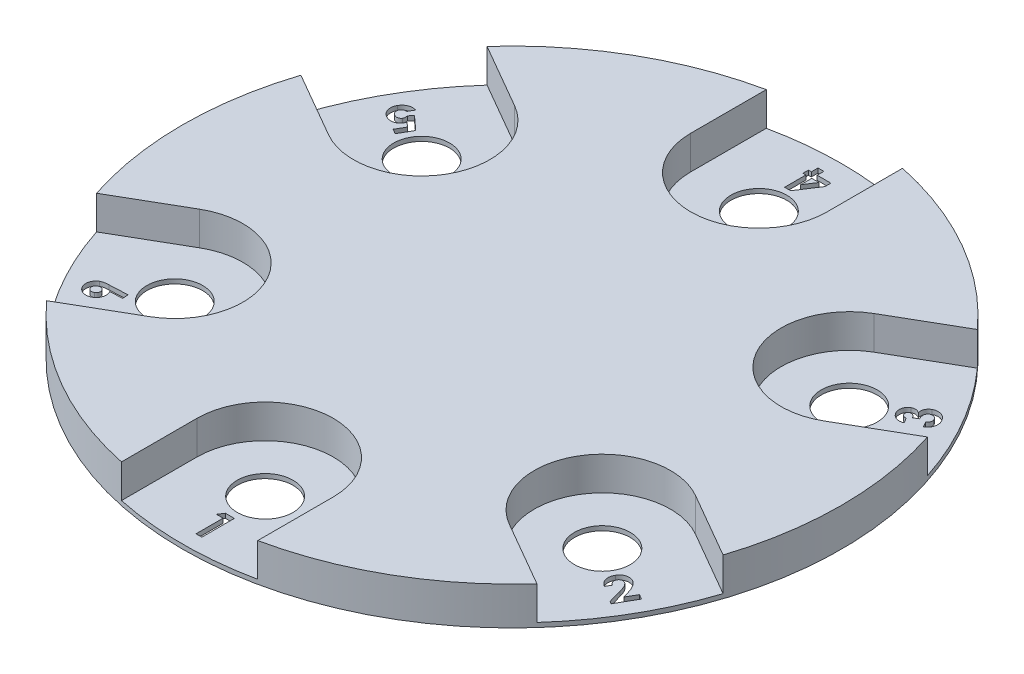
from build123d import *
from build123d.topology import SkipClean

# Parameters (mm, degrees)
BOSS_EXTRUDE1_DEPTH      = 15
BOSS_EXTRUDE2_START      = 2
SKETCH2_R                = 147.5
SKETCH2_R_2              = 12.5
SKETCH2_R_3              = 2.35
BOSS_EXTRUDE2_DEPTH      = 2
SKETCH5_R                = 6
BOSS_EXTRUDE3_DEPTH      = 25
CUT_EXTRUDE4_DEPTH       = 10
SKETCH9_R                = 2.35
CUT_EXTRUDE6_DEPTH       = 10
CUT_EXTRUDE12_DEPTH      = 15
SKETCH16_R               = 8
SKETCH16_R_2             = 5
BOSS_EXTRUDE5_DEPTH      = 5
FILLET2_R                = 10
CUT_EXTRUDE13_DEPTH      = 50
CUT_EXTRUDE13_DEPTH_BACK = 10


with BuildPart() as part:
    # Sketch1 → Boss-Extrude1 (new body)
    with BuildSketch(Plane(origin=(0, 0, 0), x_dir=(1, 0, 0), z_dir=(0, 1, 0))):
        with BuildLine():
            Line((-30.5, 110.5), (-30.5, 144.31216165))
            ThreePointArc((-30.5, 144.31216165), (-73.75, 127.738747058), (-109.727998064, 98.56985564))
            Line((-109.727998064, 98.56985564), (-80.445807118, 81.663774815))
            ThreePointArc((-80.445807118, 81.663774815), (-69.282032303, 40), (-110.945807118, 28.836225185))
            Line((-110.945807118, 28.836225185), (-140.227998064, 45.742306009))
            ThreePointArc((-140.227998064, 45.742306009), (-147.5, 0), (-140.227998064, -45.742306009))
            Line((-140.227998064, -45.742306009), (-110.945807118, -28.836225185))
            ThreePointArc((-110.945807118, -28.836225185), (-69.282032303, -40), (-80.445807118, -81.663774815))
            Line((-80.445807118, -81.663774815), (-109.727998064, -98.56985564))
            ThreePointArc((-109.727998064, -98.56985564), (-73.75, -127.738747058), (-30.5, -144.31216165))
            Line((-30.5, -144.31216165), (-30.5, -110.5))
            ThreePointArc((-30.5, -110.5), (0, -80), (30.5, -110.5))
            Line((30.5, -110.5), (30.5, -144.31216165))
            ThreePointArc((30.5, -144.31216165), (73.75, -127.738747058), (109.727998064, -98.56985564))
            Line((109.727998064, -98.56985564), (80.445807118, -81.663774815))
            ThreePointArc((80.445807118, -81.663774815), (69.282032303, -40), (110.945807118, -28.836225185))
            Line((110.945807118, -28.836225185), (140.227998064, -45.742306009))
            ThreePointArc((140.227998064, -45.742306009), (147.5, 0), (140.227998064, 45.742306009))
            Line((140.227998064, 45.742306009), (110.945807118, 28.836225185))
            ThreePointArc((110.945807118, 28.836225185), (69.282032303, 40), (80.445807118, 81.663774815))
            Line((80.445807118, 81.663774815), (109.727998064, 98.56985564))
            ThreePointArc((109.727998064, 98.56985564), (73.75, 127.738747058), (30.5, 144.31216165))
            Line((30.5, 144.31216165), (30.5, 110.5))
            ThreePointArc((30.5, 110.5), (0, 80), (-30.5, 110.5))
        make_face()
    extrude(amount=BOSS_EXTRUDE1_DEPTH)

    # Sketch2 → Boss-Extrude2 (add)
    with SkipClean():  # the faces are left unmerged after this step: merging them gives an invalid solid
        with BuildSketch(Plane(origin=(0, 0, 0), x_dir=(-1, 0, 0), z_dir=(0, -1, 0)).offset(BOSS_EXTRUDE2_START)):
            Circle(SKETCH2_R)
            with Locations((-95.695807118, 55.25)):
                Circle(SKETCH2_R_2, mode=Mode.SUBTRACT)
            with Locations((0, 110.5)):
                Circle(SKETCH2_R_2, mode=Mode.SUBTRACT)
            with Locations((95.695807118, 55.25)):
                Circle(SKETCH2_R_2, mode=Mode.SUBTRACT)
            with Locations((95.695807118, -55.25)):
                Circle(SKETCH2_R_2, mode=Mode.SUBTRACT)
            with Locations((0, -110.5)):
                Circle(SKETCH2_R_2, mode=Mode.SUBTRACT)
            with Locations((-95.695807118, -55.25)):
                Circle(SKETCH2_R_2, mode=Mode.SUBTRACT)
            with Locations((-29.344931419, -29.344931419)):
                Circle(SKETCH2_R_3, mode=Mode.SUBTRACT)
            with Locations((-29.344931419, 29.344931419)):
                Circle(SKETCH2_R_3, mode=Mode.SUBTRACT)
            with Locations((29.344931419, 29.344931419)):
                Circle(SKETCH2_R_3, mode=Mode.SUBTRACT)
            with Locations((29.344931419, -29.344931419)):
                Circle(SKETCH2_R_3, mode=Mode.SUBTRACT)
        extrude(amount=-BOSS_EXTRUDE2_DEPTH)

    # Sketch5 → Boss-Extrude3 (add)
    with SkipClean():  # the faces are left unmerged after this step: merging them gives an invalid solid
        with BuildSketch(Plane.XZ.offset(2)):
            Circle(SKETCH5_R)
        extrude(amount=BOSS_EXTRUDE3_DEPTH)

    # Sketch8 → Cut-Extrude4 (cut)
    # profile 1 of 6: a face of its own
    with SkipClean():  # the faces are left unmerged after this step: merging them gives an invalid solid
        with BuildSketch(Plane(origin=(0, 0, 0), x_dir=(1, 0, 0), z_dir=(0, 1, 0))):
            Polygon((-2.358300364, -125.947916667), (1.679086538, -125.947916667), (1.679086538, -140.5), (-0.932825855, -140.5), (-0.932825855, -128.373263889), (-3.91786859, -128.373263889), align=None)
        # profile 2 of 6: a face of its own
        with BuildSketch(Plane(origin=(0, 0, 0), x_dir=(1, 0, 0), z_dir=(0, 1, 0))):
            with BuildLine():
                Line((112.176320918, -67.191406206), (110.841213913, -69.505980358))
                add(Edge.make_bspline(
                    [(110.841213913, -69.505980358), (110.684116129, -69.400392176), (110.376710204, -69.19377925), (109.953486554, -68.852692106), (109.57704483, -68.491749005), (109.246492899, -68.112733726), (108.961789768, -67.714724314), (108.724182029, -67.29874279), (108.532634492, -66.864249776), (108.391433752, -66.413138379), (108.294129021, -65.953391263), (108.248138517, -65.490156863), (108.247066586, -65.027100158), (108.297433469, -64.563912183), (108.397451141, -64.102198553), (108.546052246, -63.641528367), (108.736857074, -63.178452471), (108.900692842, -62.880486366), (108.984307446, -62.728417508)],
                    knots=[0, 0, 0, 0, 1.154501079, 2.259105513, 3.311550315, 4.332738794, 5.32310421, 6.292303996, 7.25063568, 8.2143985, 9.171335445, 10.112849904, 11.049573671, 11.991703907, 12.94987053, 13.926728382, 14.941892913, 16, 16, 16, 16], degree=3))
                add(Edge.make_bspline(
                    [(108.984307446, -62.728417508), (109.095718932, -62.5476935), (109.313321315, -62.194713962), (109.704573811, -61.72422952), (110.139196859, -61.324956709), (110.611104734, -60.992720876), (111.11759287, -60.730742186), (111.656215655, -60.546766277), (112.221036458, -60.435164591), (112.802843497, -60.400167541), (113.381850966, -60.428966126), (113.936234952, -60.533480076), (114.460764673, -60.694733726), (114.778803949, -60.86343909), (114.936902432, -60.947303141)],
                    knots=[0, 0, 0, 0, 1.104069337, 2.156403507, 3.173016319, 4.167881568, 5.151887775, 6.130785205, 7.120726943, 8.139476423, 9.157623062, 10.129807374, 11.070320435, 12, 12, 12, 12], degree=3))
                add(Edge.make_bspline(
                    [(114.936902432, -60.947303141), (115.029134068, -61.003282321), (115.215948605, -61.116667759), (115.482916598, -61.314065578), (115.74660202, -61.529948197), (116.004308547, -61.769836787), (116.253090343, -62.035732002), (116.498552365, -62.320674432), (116.735605256, -62.630067349), (116.970545557, -62.963013614), (117.198854621, -63.329573571), (117.420804491, -63.73478093), (117.638853817, -64.180205588), (117.850574355, -64.668359641), (118.060146239, -65.196391857), (118.267054306, -65.764780333), (118.468377657, -66.374291387), (118.592656588, -66.796525456), (118.656545527, -67.013586278)],
                    knots=[0, 0, 0, 0, 0.710127908, 1.438359126, 2.183897539, 2.953538831, 3.754692063, 4.580580924, 5.429111789, 6.32024001, 7.263006244, 8.271063032, 9.361341779, 10.527535907, 11.773947238, 13.101804454, 14.510104335, 16, 16, 16, 16], degree=3))
                Line((118.656545527, -67.013586278), (119.318268868, -69.264028652))
                Line((119.318268868, -69.264028652), (121.883539968, -64.8243606))
                Line((121.883539968, -64.8243606), (124.078595808, -66.092420746))
                Line((124.078595808, -66.092420746), (119.093807647, -74.723974983))
                Line((119.093807647, -74.723974983), (117.959841217, -74.068081804))
                Line((117.959841217, -74.068081804), (116.25160387, -67.943497052))
                add(Edge.make_bspline(
                    [(116.25160387, -67.943497052), (116.201428103, -67.765582808), (116.104441768, -67.421686714), (115.958371257, -66.925539823), (115.804413079, -66.471095668), (115.658335029, -66.052405603), (115.50601187, -65.675188206), (115.358842541, -65.335651054), (115.210189669, -65.03674274), (115.015886109, -64.698149849), (114.767658169, -64.331112678), (114.450737243, -63.953649468), (114.1234789, -63.64012101), (113.88126605, -63.483017583), (113.765039952, -63.407631333)],
                    knots=[0, 0, 0, 0, 1.256867959, 2.429439999, 3.515817361, 4.518844834, 5.443861826, 6.281023943, 7.034435958, 7.712118835, 8.934338007, 10.040779141, 11.059865744, 12, 12, 12, 12], degree=3))
                add(Edge.make_bspline(
                    [(113.765039952, -63.407631333), (113.646621703, -63.346180702), (113.416798458, -63.226918819), (113.042454561, -63.135683019), (112.665912854, -63.122899182), (112.295091354, -63.193123037), (111.939965758, -63.327604497), (111.620352104, -63.540867761), (111.335953368, -63.819742653), (111.190561497, -64.047531225), (111.115231508, -64.16555234)],
                    knots=[0, 0, 0, 0, 1.034916509, 2.008540692, 2.969133977, 3.944869128, 4.926211327, 5.90332201, 6.913675642, 8, 8, 8, 8], degree=3))
                add(Edge.make_bspline(
                    [(111.115231508, -64.16555234), (111.080762504, -64.229003142), (111.013359502, -64.353079094), (110.937921114, -64.548232897), (110.881101645, -64.743983885), (110.848768157, -64.943684968), (110.841027747, -65.14606807), (110.852040593, -65.351315035), (110.887310967, -65.558629026), (110.946638465, -65.765094421), (111.024249423, -65.970220049), (111.127693054, -66.16693687), (111.246849472, -66.359065026), (111.391843577, -66.540711406), (111.558768402, -66.713938168), (111.742457782, -66.885143779), (111.949988642, -67.045079222), (112.099806671, -67.141938675), (112.176320918, -67.191406206)],
                    knots=[0, 0, 0, 0, 0.967346954, 1.891615089, 2.799014584, 3.696537969, 4.596422639, 5.50997533, 6.448189623, 7.409286192, 8.38684589, 9.383325634, 10.38464908, 11.414309184, 12.492613261, 13.608367401, 14.778558453, 16, 16, 16, 16], degree=3))
            make_face()
        # profile 3 of 6: a face of its own
        with BuildSketch(Plane(origin=(0, 0, 0), x_dir=(1, 0, 0), z_dir=(0, 1, 0))):
            with BuildLine():
                Line((113.184938873, 63.277800775), (114.499640312, 60.998207592))
                add(Edge.make_bspline(
                    [(114.499640312, 60.998207592), (114.377837788, 60.949842932), (114.138013151, 60.854614715), (113.774521601, 60.74404349), (113.41551985, 60.665764431), (113.063234708, 60.61064622), (112.714875235, 60.59234627), (112.372616706, 60.595983547), (112.035700957, 60.633657408), (111.816430821, 60.682381351), (111.70699291, 60.706699513)],
                    knots=[0, 0, 0, 0, 1.100637514, 2.16711431, 3.187091716, 4.185678312, 5.158749046, 6.113954241, 7.058672956, 8, 8, 8, 8], degree=3))
                add(Edge.make_bspline(
                    [(111.70699291, 60.706699513), (111.558189442, 60.748130802), (111.264078143, 60.830020091), (110.846249953, 61.008615098), (110.452016408, 61.220802894), (110.086792265, 61.477860149), (109.742755922, 61.768510729), (109.431763202, 62.10563088), (109.138763497, 62.474895586), (108.97455817, 62.748164583), (108.891024861, 62.887179948)],
                    knots=[0, 0, 0, 0, 1.010869218, 1.99799147, 2.969307492, 3.938723657, 4.918429718, 5.913645952, 6.938645537, 8, 8, 8, 8], degree=3))
                add(Edge.make_bspline(
                    [(108.891024861, 62.887179948), (108.821891922, 63.014390812), (108.686206102, 63.264065), (108.521029024, 63.651683788), (108.399537354, 64.042793329), (108.313181074, 64.434654418), (108.268841333, 64.829369457), (108.266889973, 65.225854841), (108.3021419, 65.625012834), (108.37492483, 66.021029831), (108.480800999, 66.406026372), (108.621675925, 66.768695026), (108.790221681, 67.107025076), (108.993144414, 67.416072495), (109.222076996, 67.702596031), (109.481752418, 67.962009505), (109.773343349, 68.195552747), (109.98657261, 68.326970353), (110.094953229, 68.393767572)],
                    knots=[0, 0, 0, 0, 1.10807358, 2.174793583, 3.219495373, 4.239455406, 5.242563574, 6.254351592, 7.270043138, 8.306073729, 9.333090522, 10.322281198, 11.280465358, 12.221397179, 13.147387919, 14.083750151, 15.026004476, 16, 16, 16, 16], degree=3))
                add(Edge.make_bspline(
                    [(110.094953229, 68.393767572), (110.233908908, 68.467096275), (110.508414725, 68.611956534), (110.951795535, 68.752282882), (111.408894048, 68.821183193), (111.877311104, 68.828471533), (112.351019353, 68.761742647), (112.825447796, 68.631137791), (113.292959306, 68.419269196), (113.58922215, 68.235003654), (113.741719305, 68.140155543)],
                    knots=[0, 0, 0, 0, 0.974570112, 1.925255358, 2.872042329, 3.837937071, 4.824805201, 5.833908719, 6.885034805, 8, 8, 8, 8], degree=3))
                add(Edge.make_bspline(
                    [(113.741719305, 68.140155543), (113.717524545, 68.249633136), (113.669856261, 68.465324837), (113.631221086, 68.789271311), (113.61118042, 69.106810813), (113.622519511, 69.417518767), (113.648300978, 69.723345656), (113.709129388, 70.021172063), (113.790479512, 70.313634438), (113.895027106, 70.598589787), (114.022507197, 70.873434483), (114.176731451, 71.132227143), (114.343487977, 71.38225923), (114.53835034, 71.612414399), (114.751616931, 71.828951581), (114.986148562, 72.031291756), (115.242385417, 72.217332217), (115.424863557, 72.328420569), (115.51700351, 72.384513181)],
                    knots=[0, 0, 0, 0, 1.084587699, 2.136844246, 3.154180313, 4.160940237, 5.143600227, 6.121206092, 7.097906682, 8.079846247, 9.056003269, 10.025476853, 10.99330664, 11.961501957, 12.939153063, 13.932779332, 14.956183924, 16, 16, 16, 16], degree=3))
                add(Edge.make_bspline(
                    [(115.51700351, 72.384513181), (115.656400394, 72.460509075), (115.930737003, 72.610070924), (116.363066562, 72.777997556), (116.800142626, 72.902277452), (117.243795278, 72.978888181), (117.694414926, 73.004168263), (118.150792261, 72.984444981), (118.613334188, 72.91236287), (119.076766656, 72.796189257), (119.532573334, 72.63769618), (119.969018406, 72.43363216), (120.37896583, 72.182118746), (120.767940041, 71.895194153), (121.12875985, 71.560533707), (121.467830748, 71.18727535), (121.780735814, 70.768533148), (121.964695413, 70.466044736), (122.058444816, 70.311890735)],
                    knots=[0, 0, 0, 0, 0.993527377, 1.955287111, 2.897436886, 3.83594311, 4.768709181, 5.719078948, 6.69169555, 7.695422729, 8.707857846, 9.709756724, 10.706540813, 11.715604557, 12.732128862, 13.783438489, 14.870396979, 16, 16, 16, 16], degree=3))
                add(Edge.make_bspline(
                    [(122.058444816, 70.311890735), (122.140823851, 70.162630929), (122.30234635, 69.86997374), (122.494487345, 69.415695997), (122.641486439, 68.963204784), (122.741883278, 68.511312894), (122.795095073, 68.060993545), (122.799843134, 67.611780437), (122.763468064, 67.163068124), (122.674967357, 66.71887309), (122.542842578, 66.284036002), (122.372704915, 65.861888735), (122.151215231, 65.462144593), (121.889561675, 65.078738542), (121.581860111, 64.715592129), (121.23404969, 64.367108307), (120.84133541, 64.038901551), (120.554978029, 63.842007807), (120.408509085, 63.741298621)],
                    knots=[0, 0, 0, 0, 1.080781249, 2.119113037, 3.122919527, 4.094945026, 5.050574497, 5.993659493, 6.940061788, 7.901022981, 8.860342232, 9.819483271, 10.78212307, 11.753151488, 12.759320435, 13.796572391, 14.872968757, 16, 16, 16, 16], degree=3))
                Line((120.408509085, 63.741298621), (119.052996515, 66.087938662))
                add(Edge.make_bspline(
                    [(119.052996515, 66.087938662), (119.187655558, 66.20483535), (119.443367817, 66.42681759), (119.755681364, 66.800423038), (119.977730848, 67.187184264), (120.109092729, 67.585280256), (120.156501471, 67.987900744), (120.123314345, 68.393042166), (120.007791177, 68.797627316), (119.875842645, 69.050716009), (119.808002442, 69.180839387)],
                    knots=[0, 0, 0, 0, 1.215812048, 2.308779549, 3.306708855, 4.242178214, 5.150446475, 6.055439415, 7.00022088, 8, 8, 8, 8], degree=3))
                add(Edge.make_bspline(
                    [(119.808002442, 69.180839387), (119.767347111, 69.247656705), (119.687377528, 69.379087272), (119.550215592, 69.560112984), (119.400312438, 69.721678188), (119.239254859, 69.865128368), (119.067336532, 69.99168511), (118.881683848, 70.096410773), (118.686106835, 70.185126157), (118.413045123, 70.271788251), (118.065418235, 70.336392342), (117.646312688, 70.33357542), (117.236720154, 70.234285597), (116.986031175, 70.108151834), (116.857940676, 70.043703302)],
                    knots=[0, 0, 0, 0, 0.820951101, 1.614821893, 2.380179406, 3.131809883, 3.87676154, 4.617156876, 5.366220277, 6.127759162, 7.62087363, 9.059762602, 10.497674375, 12, 12, 12, 12], degree=3))
                add(Edge.make_bspline(
                    [(116.857940676, 70.043703302), (116.78973405, 70.001634761), (116.654527551, 69.918241981), (116.474013608, 69.765354419), (116.315031671, 69.594656137), (116.177490973, 69.406623972), (116.058888732, 69.201248068), (115.967127768, 68.974969456), (115.893523457, 68.732260298), (115.844046647, 68.47240742), (115.821885315, 68.198954683), (115.823469249, 67.913680486), (115.860372646, 67.619007832), (115.925479765, 67.314020263), (116.019134953, 66.999222346), (116.143426499, 66.674569015), (116.294211061, 66.339106978), (116.41435348, 66.117322014), (116.476065092, 66.003401319)],
                    knots=[0, 0, 0, 0, 0.848466509, 1.681921424, 2.498142113, 3.315985831, 4.146380314, 5.005223533, 5.898042427, 6.831295342, 7.80297426, 8.802105615, 9.849699668, 10.944580868, 12.104758162, 13.327138069, 14.627074253, 16, 16, 16, 16], degree=3))
                Line((116.476065092, 66.003401319), (114.444253777, 64.831538839))
                add(Edge.make_bspline(
                    [(114.444253777, 64.831538839), (114.355790128, 64.958331394), (114.18990611, 65.196088471), (113.929850862, 65.507264103), (113.689524929, 65.7609731), (113.454619877, 65.949095527), (113.224513604, 66.088672397), (112.994489152, 66.191263303), (112.75817456, 66.260073297), (112.519357199, 66.291244994), (112.285213818, 66.291110872), (112.058978413, 66.263191641), (111.843901116, 66.199228275), (111.711887648, 66.130901488), (111.645776213, 66.096683905)],
                    knots=[0, 0, 0, 0, 1.631543613, 3.059414974, 4.278262358, 5.314924273, 6.226342713, 7.112821333, 7.966824641, 8.815635641, 9.646651462, 10.433090686, 11.215302614, 12, 12, 12, 12], degree=3))
                add(Edge.make_bspline(
                    [(111.645776213, 66.096683905), (111.566615765, 66.045353459), (111.412273967, 65.945272756), (111.224347927, 65.74514441), (111.088559015, 65.51102005), (110.997518237, 65.252262364), (110.96208785, 64.974780064), (110.988924337, 64.690124274), (111.065867271, 64.400298694), (111.163695851, 64.219627479), (111.214344255, 64.126089287)],
                    knots=[0, 0, 0, 0, 0.998984466, 1.947753752, 2.881940502, 3.854199926, 4.842042555, 5.825566253, 6.874239024, 8, 8, 8, 8], degree=3))
                add(Edge.make_bspline(
                    [(111.214344255, 64.126089287), (111.266393608, 64.045628767), (111.369294992, 63.886558608), (111.565158157, 63.678891169), (111.795165467, 63.509259179), (112.052339597, 63.376413889), (112.326480222, 63.277895537), (112.611702381, 63.234802493), (112.900306191, 63.223362301), (113.089068974, 63.259464824), (113.184938873, 63.277800775)],
                    knots=[0, 0, 0, 0, 1.000733368, 1.978446293, 2.966247666, 3.975356808, 4.997380958, 5.996461757, 6.982431784, 8, 8, 8, 8], degree=3))
            make_face()
        # profile 4 of 6: a face of its own
        with BuildSketch(Plane(origin=(0, 0, 0), x_dir=(1, 0, 0), z_dir=(0, 1, 0))):
            Polygon((-0.824967865, 125.574786325), (-3.544738248, 125.574786325), (-3.544738248, 135.089610043), (-4.850694444, 135.089610043), (-4.850694444, 137.514957265), (-3.544738248, 137.514957265), (-3.544738248, 140.5), (-0.932825855, 140.5), (-0.932825855, 137.514957265), (5.223824786, 137.514957265), (5.223824786, 134.870978983), align=None)
            Polygon((-0.932825855, 135.089610043), (-0.932825855, 130.13688777), (2.288338425, 135.089610043), align=None, mode=Mode.SUBTRACT)
        # profile 5 of 6: a face of its own
        with BuildSketch(Plane(origin=(0, 0, 0), x_dir=(1, 0, 0), z_dir=(0, 1, 0))):
            with BuildLine():
                Line((-108.089377642, 65.002180529), (-111.459211042, 59.166188775))
                Line((-111.459211042, 59.166188775), (-113.645521639, 60.42841876))
                Line((-113.645521639, 60.42841876), (-111.298881598, 64.49495647))
                Line((-111.298881598, 64.49495647), (-113.275306378, 66.313966887))
                add(Edge.make_bspline(
                    [(-113.275306378, 66.313966887), (-113.296066524, 66.232817656), (-113.336885098, 66.073262139), (-113.42369539, 65.847944459), (-113.515973399, 65.636158825), (-113.58728448, 65.504102333), (-113.622200993, 65.439442648)],
                    knots=[0, 0, 0, 0, 1.06420543, 2.092439393, 3.065988606, 4, 4, 4, 4], degree=3))
                add(Edge.make_bspline(
                    [(-113.622200993, 65.439442648), (-113.705001145, 65.302560129), (-113.867434144, 65.034031176), (-114.153698591, 64.66819868), (-114.463482852, 64.339628297), (-114.79948195, 64.048859712), (-115.16354699, 63.801000868), (-115.55140598, 63.588212694), (-115.966497413, 63.417641781), (-116.402342477, 63.283162661), (-116.850726084, 63.193652338), (-117.303806045, 63.149274109), (-117.757379147, 63.151091105), (-118.211059514, 63.206184812), (-118.6644414, 63.301546291), (-119.117220937, 63.446718057), (-119.569379845, 63.639383283), (-119.862670167, 63.798717344), (-120.012058097, 63.879874422)],
                    knots=[0, 0, 0, 0, 1.041508026, 2.043175864, 3.019433695, 3.980089598, 4.931838607, 5.883734992, 6.857217752, 7.850487817, 8.851194899, 9.830751981, 10.812046429, 11.799915004, 12.803182057, 13.826287158, 14.892815627, 16, 16, 16, 16], degree=3))
                add(Edge.make_bspline(
                    [(-120.012058097, 63.879874422), (-120.158646007, 63.969500796), (-120.447763662, 64.146272312), (-120.844753386, 64.454478436), (-121.202309886, 64.789276974), (-121.516117021, 65.155699217), (-121.79549181, 65.545551658), (-122.02927684, 65.968876653), (-122.220773952, 66.419951826), (-122.375479886, 66.891518775), (-122.481731252, 67.376101216), (-122.544450718, 67.859951914), (-122.556830455, 68.338753724), (-122.517401399, 68.811239035), (-122.43425975, 69.27872807), (-122.296999543, 69.739923866), (-122.115439713, 70.196488301), (-121.955698857, 70.486987281), (-121.874794726, 70.634116626)],
                    knots=[0, 0, 0, 0, 1.055785886, 2.082343212, 3.084049436, 4.062609617, 5.044011067, 6.028227449, 7.029274181, 8.053342162, 9.075316504, 10.075025092, 11.049197908, 12.014258794, 12.985789681, 13.963254867, 14.9684474, 16, 16, 16, 16], degree=3))
                add(Edge.make_bspline(
                    [(-121.874794726, 70.634116626), (-121.797421159, 70.763898679), (-121.644961965, 71.019625125), (-121.380152637, 71.371165505), (-121.099630154, 71.6947329), (-120.798118269, 71.987086234), (-120.477382141, 72.250982949), (-120.133884693, 72.481560554), (-119.771911924, 72.68419531), (-119.389641255, 72.851905893), (-118.995347703, 72.989685801), (-118.590975942, 73.088085063), (-118.181591484, 73.153812577), (-117.764874291, 73.178679595), (-117.341592595, 73.170747064), (-116.911580453, 73.123059234), (-116.474987614, 73.03823952), (-116.185954019, 72.955721094), (-116.038802972, 72.913709809)],
                    knots=[0, 0, 0, 0, 1.064186621, 2.096905199, 3.096744185, 4.079862237, 5.05317607, 6.019963199, 6.991758056, 7.972870521, 8.958275673, 9.931589506, 10.902104652, 11.876502018, 12.869705299, 13.882338009, 14.921868655, 16, 16, 16, 16], degree=3))
                Line((-116.038802972, 72.913709809), (-117.475937805, 70.424230809))
                add(Edge.make_bspline(
                    [(-117.475937805, 70.424230809), (-117.597514848, 70.428587596), (-117.833696112, 70.437051296), (-118.178357023, 70.393232537), (-118.502968016, 70.314807006), (-118.800097835, 70.18310381), (-119.073776677, 70.021323782), (-119.315138942, 69.819372131), (-119.52888908, 69.584745556), (-119.642485477, 69.404880487), (-119.700144452, 69.313585026)],
                    knots=[0, 0, 0, 0, 1.109804984, 2.155959184, 3.163698306, 4.149933146, 5.11373455, 6.059497778, 7.015044738, 8, 8, 8, 8], degree=3))
                add(Edge.make_bspline(
                    [(-119.700144452, 69.313585026), (-119.735375426, 69.248107), (-119.804909599, 69.118875253), (-119.886817907, 68.916970295), (-119.945935863, 68.711820857), (-119.980403299, 68.50339333), (-119.994976513, 68.292570057), (-119.989707172, 68.078594383), (-119.959883774, 67.8617279), (-119.907457256, 67.645185714), (-119.834924736, 67.432125836), (-119.741940744, 67.229140693), (-119.629941825, 67.035813034), (-119.495142293, 66.856583197), (-119.343064359, 66.685709192), (-119.169686243, 66.528225801), (-118.976844355, 66.381271222), (-118.836183083, 66.29617491), (-118.764403517, 66.25275019)],
                    knots=[0, 0, 0, 0, 0.997812901, 1.969349307, 2.919180086, 3.858649584, 4.80029085, 5.753074062, 6.727322429, 7.733628953, 8.740358278, 9.744548131, 10.726887462, 11.734123912, 12.750445359, 13.793955032, 14.874253371, 16, 16, 16, 16], degree=3))
                add(Edge.make_bspline(
                    [(-118.764403517, 66.25275019), (-118.622922282, 66.178223855), (-118.34990509, 66.034409935), (-117.911627097, 65.914275289), (-117.475971148, 65.875255371), (-117.119080972, 65.923188205), (-116.84420604, 65.993780461), (-116.652877557, 66.07211859), (-116.470866556, 66.158238378), (-116.306193756, 66.267320015), (-116.151116228, 66.39051856), (-116.014064228, 66.533747924), (-115.884171413, 66.689126232), (-115.814758116, 66.805547892), (-115.779360782, 66.864917157)],
                    knots=[0, 0, 0, 0, 1.688735906, 3.25876387, 4.776101482, 6.289492917, 7.045628948, 7.775410633, 8.47475427, 9.17387086, 9.86153951, 10.567210814, 11.269348664, 12, 12, 12, 12], degree=3))
                add(Edge.make_bspline(
                    [(-115.779360782, 66.864917157), (-115.744607032, 66.93119322), (-115.674416112, 67.065048642), (-115.600258854, 67.281064859), (-115.549275596, 67.50883896), (-115.527833402, 67.749615897), (-115.52709357, 68.002466438), (-115.555077043, 68.267776185), (-115.607022382, 68.54491787), (-115.661133388, 68.730973111), (-115.688993277, 68.826766533)],
                    knots=[0, 0, 0, 0, 0.887533944, 1.792520965, 2.702349485, 3.652965451, 4.656779893, 5.700387855, 6.816009077, 8, 8, 8, 8], degree=3))
                Line((-115.688993277, 68.826766533), (-114.138170293, 70.505853071))
                Line((-114.138170293, 70.505853071), (-108.089377642, 65.002180529))
            make_face()
        # profile 6 of 6: a face of its own
        with BuildSketch(Plane(origin=(0, 0, 0), x_dir=(1, 0, 0), z_dir=(0, 1, 0))):
            with BuildLine():
                Line((-108.791912114, -63.056254634), (-108.634497751, -65.653591624))
                Line((-108.634497751, -65.653591624), (-114.129425051, -65.924694138))
                add(Edge.make_bspline(
                    [(-114.129425051, -65.924694138), (-114.057821333, -66.056524935), (-113.916678086, -66.316386116), (-113.752666813, -66.723768505), (-113.637312444, -67.136777603), (-113.557826407, -67.554071439), (-113.531734315, -67.978475668), (-113.540973803, -68.408316378), (-113.602374952, -68.84347595), (-113.702581411, -69.278967706), (-113.845383093, -69.704990726), (-114.022267125, -70.112324992), (-114.239205778, -70.493475236), (-114.495031296, -70.848457053), (-114.788286645, -71.179219779), (-115.118847404, -71.486157722), (-115.48772109, -71.76721982), (-115.754542109, -71.931045714), (-115.890133852, -72.01429792)],
                    knots=[0, 0, 0, 0, 1.018338026, 2.007319446, 2.974571167, 3.927282038, 4.886485245, 5.856973584, 6.842580271, 7.865526957, 8.888132973, 9.889912956, 10.87710919, 11.86063677, 12.85646456, 13.874460374, 14.919854132, 16, 16, 16, 16], degree=3))
                add(Edge.make_bspline(
                    [(-115.890133852, -72.01429792), (-116.024720644, -72.088251079), (-116.289737752, -72.233873484), (-116.707883257, -72.397784413), (-117.128192607, -72.526183658), (-117.555590184, -72.605240643), (-117.987461133, -72.635614544), (-118.424086029, -72.628761468), (-118.866142116, -72.570991426), (-119.308265226, -72.473062556), (-119.739590043, -72.334216508), (-120.148260766, -72.159088702), (-120.531611968, -71.951692319), (-120.885255626, -71.704929745), (-121.213647872, -71.423879823), (-121.514422687, -71.106791467), (-121.791462157, -70.757001025), (-121.947395667, -70.500244413), (-122.026378927, -70.370192351)],
                    knots=[0, 0, 0, 0, 1.041763046, 2.051353072, 3.04293035, 4.022581766, 4.995208902, 5.978519677, 6.982683446, 8.016812889, 9.049678629, 10.054665785, 11.032003656, 12.003891977, 12.977190276, 13.961894674, 14.967661259, 16, 16, 16, 16], degree=3))
                add(Edge.make_bspline(
                    [(-122.026378927, -70.370192351), (-122.102138462, -70.230683458), (-122.250976269, -69.956603137), (-122.422023068, -69.526787332), (-122.553106437, -69.095385533), (-122.63135924, -68.658022671), (-122.663946236, -68.218378465), (-122.649016318, -67.775710272), (-122.586685948, -67.329463696), (-122.47910536, -66.884655603), (-122.332067172, -66.453050253), (-122.152742939, -66.044892267), (-121.946927737, -65.662912814), (-121.70415064, -65.313069797), (-121.430290864, -64.993168804), (-121.129123306, -64.699874275), (-120.795711705, -64.4347855), (-120.552055327, -64.285880982), (-120.428914651, -64.21062663)],
                    knots=[0, 0, 0, 0, 1.077273163, 2.116419726, 3.135316905, 4.13457865, 5.127084635, 6.124077708, 7.136651265, 8.181814891, 9.227311783, 10.229010968, 11.206485483, 12.169327126, 13.11484928, 14.062188885, 15.020656167, 16, 16, 16, 16], degree=3))
                add(Edge.make_bspline(
                    [(-120.428914651, -64.21062663), (-120.331404174, -64.157909898), (-120.134766452, -64.051602368), (-119.827051971, -63.91386582), (-119.502846863, -63.804912075), (-119.221102552, -63.724729998), (-118.975034597, -63.671472855), (-118.762298713, -63.633010044), (-118.521619776, -63.603102466), (-118.253668673, -63.5697864), (-117.957124991, -63.541806189), (-117.632687368, -63.51433568), (-117.280637575, -63.496125224), (-117.036726827, -63.482883694), (-116.91041213, -63.476026269)],
                    knots=[0, 0, 0, 0, 1.098453923, 2.215120709, 3.33589115, 4.485461064, 5.116379259, 5.830457112, 6.627221513, 7.519526552, 8.506534278, 9.579013926, 10.746237616, 12, 12, 12, 12], degree=3))
                Line((-116.91041213, -63.476026269), (-108.791912114, -63.056254634))
            make_face()
            with BuildLine():
                add(Edge.make_bspline(
                    [(-116.449829365, -67.084896294), (-116.517730665, -66.981635512), (-116.650029881, -66.780441713), (-116.914731314, -66.53490691), (-117.224543579, -66.354323503), (-117.571135721, -66.239945173), (-117.9371328, -66.18925593), (-118.309844011, -66.213312861), (-118.68076431, -66.313821373), (-118.911133521, -66.434137992), (-119.029675869, -66.496049974)],
                    knots=[0, 0, 0, 0, 1.00210531, 1.952506739, 2.905171773, 3.897133041, 4.901727284, 5.891420201, 6.914976533, 8, 8, 8, 8], degree=3))
                add(Edge.make_bspline(
                    [(-119.029675869, -66.496049974), (-119.142758687, -66.568593924), (-119.362558611, -66.709598146), (-119.632291856, -66.988524725), (-119.841437866, -67.306451518), (-119.98146465, -67.659023827), (-120.054244867, -68.023869992), (-120.060328831, -68.383628177), (-119.98745441, -68.731539172), (-119.881874091, -68.940783783), (-119.828408007, -69.04674567)],
                    knots=[0, 0, 0, 0, 1.084370473, 2.107699054, 3.113315164, 4.147317016, 5.15759702, 6.109268, 7.042529552, 8, 8, 8, 8], degree=3))
                add(Edge.make_bspline(
                    [(-119.828408007, -69.04674567), (-119.760530352, -69.1500507), (-119.627520786, -69.352481931), (-119.358728278, -69.600187371), (-119.045031484, -69.788230037), (-118.692013873, -69.916433779), (-118.316485427, -69.974557556), (-117.933855211, -69.956829528), (-117.552866704, -69.859766504), (-117.317397674, -69.736824578), (-117.196090048, -69.673488041)],
                    knots=[0, 0, 0, 0, 0.981808457, 1.923901433, 2.882453353, 3.879164247, 4.897378771, 5.889358535, 6.912651468, 8, 8, 8, 8], degree=3))
                add(Edge.make_bspline(
                    [(-117.196090048, -69.673488041), (-117.082869416, -69.602087554), (-116.862357652, -69.46302591), (-116.59543468, -69.18517357), (-116.386627113, -68.872592312), (-116.252271823, -68.522835379), (-116.184920403, -68.156920761), (-116.18788942, -67.787155448), (-116.278678356, -67.423502028), (-116.391846438, -67.199609912), (-116.449829365, -67.084896294)],
                    knots=[0, 0, 0, 0, 1.064723496, 2.073686132, 3.047963589, 4.047315269, 5.04051072, 6.002177851, 6.976393588, 8, 8, 8, 8], degree=3))
            make_face(mode=Mode.SUBTRACT)
        extrude(amount=-CUT_EXTRUDE4_DEPTH, mode=Mode.SUBTRACT)


with BuildPart() as cut_extrude4_piece_1:
    # of the separate pieces the step leaves, piece 1, a body of its own (cut_extrude4_pieces)
    add(part.part.solids().sort_by_distance((140.227998064, 0, -45.742306009))[0])

    # Sketch9 → Cut-Extrude6 (cut)
    with SkipClean():  # the faces are left unmerged after this step: merging them gives an invalid solid
        with BuildSketch(Plane.XZ.offset(2)):
            with Locations((29.344931419, 29.344931419)):
                Circle(SKETCH9_R)
            with Locations((-29.344931419, 29.344931419)):
                Circle(SKETCH9_R)
            with Locations((-29.344931419, -29.344931419)):
                Circle(SKETCH9_R)
            with Locations((29.344931419, -29.344931419)):
                Circle(SKETCH9_R)
        extrude(amount=-CUT_EXTRUDE6_DEPTH, mode=Mode.SUBTRACT)

    # Sketch14 → Cut-Extrude12 (cut)
    with SkipClean():  # the faces are left unmerged after this step: merging them gives an invalid solid
        with BuildSketch(Plane.XZ.offset(2)):
            with BuildLine():
                ThreePointArc((-136.699989579, 40.241307746), (-142.5, 0), (-136.699989579, -40.241307746))
                Line((-136.699989579, -40.241307746), (-69.978869047, -1.719850846))
                ThreePointArc((-69.978869047, -1.719850846), (-70, 0), (-69.978869047, 1.719850846))
                Line((-69.978869047, 1.719850846), (-136.699989579, 40.241307746))
            make_face()
            with BuildLine():
                Line((-69.814755108, -5.089201234), (-98.945807118, -21.908021954))
                ThreePointArc((-98.945807118, -21.908021954), (-66.683956091, -38.5), (-68.445807118, -74.735571585))
                Line((-68.445807118, -74.735571585), (-39.314755108, -57.916750865))
                ThreePointArc((-39.314755108, -57.916750865), (-60.621778265, -35), (-69.814755108, -5.089201234))
            make_face()
            with BuildLine():
                ThreePointArc((-68.445807118, 74.735571585), (-66.683956091, 38.5), (-98.945807118, 21.908021954))
                Line((-98.945807118, 21.908021954), (-69.814755108, 5.089201234))
                ThreePointArc((-69.814755108, 5.089201234), (-60.621778265, 35), (-39.314755108, 57.916750865))
                Line((-39.314755108, 57.916750865), (-68.445807118, 74.735571585))
            make_face()
            with BuildLine():
                Line((-36.478869047, -59.7435529), (-103.199989579, -98.2650098))
                ThreePointArc((-103.199989579, -98.2650098), (-71.25, -123.408620039), (-33.5, -138.506317545))
                Line((-33.5, -138.506317545), (-33.5, -61.463403746))
                ThreePointArc((-33.5, -61.463403746), (-35, -60.621778265), (-36.478869047, -59.7435529))
            make_face()
            with BuildLine():
                ThreePointArc((-33.5, 138.506317545), (-71.25, 123.408620039), (-103.199989579, 98.2650098))
                Line((-103.199989579, 98.2650098), (-36.478869047, 59.7435529))
                ThreePointArc((-36.478869047, 59.7435529), (-35, 60.621778265), (-33.5, 61.463403746))
                Line((-33.5, 61.463403746), (-33.5, 138.506317545))
            make_face()
            with BuildLine():
                Line((-30.5, -63.0059521), (-30.5, -96.643593539))
                ThreePointArc((-30.5, -96.643593539), (0, -77), (30.5, -96.643593539))
                Line((30.5, -96.643593539), (30.5, -63.0059521))
                ThreePointArc((30.5, -63.0059521), (0, -70), (-30.5, -63.0059521))
            make_face()
            with BuildLine():
                ThreePointArc((30.5, 96.643593539), (0, 77), (-30.5, 96.643593539))
                Line((-30.5, 96.643593539), (-30.5, 63.0059521))
                ThreePointArc((-30.5, 63.0059521), (0, 70), (30.5, 63.0059521))
                Line((30.5, 63.0059521), (30.5, 96.643593539))
            make_face()
            with BuildLine():
                Line((33.5, -61.463403746), (33.5, -138.506317545))
                ThreePointArc((33.5, -138.506317545), (71.25, -123.408620039), (103.199989579, -98.2650098))
                Line((103.199989579, -98.2650098), (36.478869047, -59.7435529))
                ThreePointArc((36.478869047, -59.7435529), (35, -60.621778265), (33.5, -61.463403746))
            make_face()
            with BuildLine():
                ThreePointArc((103.199989579, 98.2650098), (71.25, 123.408620039), (33.5, 138.506317545))
                Line((33.5, 138.506317545), (33.5, 61.463403746))
                ThreePointArc((33.5, 61.463403746), (35, 60.621778265), (36.478869047, 59.7435529))
                Line((36.478869047, 59.7435529), (103.199989579, 98.2650098))
            make_face()
            with BuildLine():
                Line((39.314755108, -57.916750865), (68.445807118, -74.735571585))
                ThreePointArc((68.445807118, -74.735571585), (66.683956091, -38.5), (98.945807118, -21.908021954))
                Line((98.945807118, -21.908021954), (69.814755108, -5.089201234))
                ThreePointArc((69.814755108, -5.089201234), (60.621778265, -35), (39.314755108, -57.916750865))
            make_face()
            with BuildLine():
                ThreePointArc((98.945807118, 21.908021954), (66.683956091, 38.5), (68.445807118, 74.735571585))
                Line((68.445807118, 74.735571585), (39.314755108, 57.916750865))
                ThreePointArc((39.314755108, 57.916750865), (60.621778265, 35), (69.814755108, 5.089201234))
                Line((69.814755108, 5.089201234), (98.945807118, 21.908021954))
            make_face()
            with BuildLine():
                Line((69.978869047, -1.719850846), (136.699989579, -40.241307746))
                ThreePointArc((136.699989579, -40.241307746), (142.5, 0), (136.699989579, 40.241307746))
                Line((136.699989579, 40.241307746), (69.978869047, 1.719850846))
                ThreePointArc((69.978869047, 1.719850846), (70, 0), (69.978869047, -1.719850846))
            make_face()
        extrude(amount=-CUT_EXTRUDE12_DEPTH, mode=Mode.SUBTRACT)

    # Sketch16 → Boss-Extrude5 (add)
    with SkipClean():  # the faces are left unmerged after this step: merging them gives an invalid solid
        with BuildSketch(Plane.XZ.offset(2)):
            with Locations((0, 85)):
                Circle(SKETCH16_R)
            with Locations((0, 85)):
                Circle(SKETCH16_R_2, mode=Mode.SUBTRACT)
        extrude(amount=BOSS_EXTRUDE5_DEPTH)

    # Fillet2
    fillet2_edges = [cut_extrude4_piece_1.edges().sort_by_distance(p)[0] for p in [
        (-6, -2, 0),
    ]]
    fillet(fillet2_edges, radius=FILLET2_R)

    # Sketch17 → Cut-Extrude13 (cut, two sides: drawn at the far end of the back side and taken through both)
    with SkipClean():  # the faces are left unmerged after this step: merging them gives an invalid solid
        with BuildSketch(Plane.XZ.offset(2).offset(-CUT_EXTRUDE13_DEPTH_BACK)):
            Polygon((-10, 17.320508076), (-20, 0), (-10, -17.320508076), (10, -17.320508076), (20, 0), (10, 17.320508076), align=None)
        extrude(amount=CUT_EXTRUDE13_DEPTH + CUT_EXTRUDE13_DEPTH_BACK, mode=Mode.SUBTRACT)


with BuildPart() as cut_extrude4_piece_2:
    # of the separate pieces the step leaves, piece 2, a body of its own (cut_extrude4_pieces)
    add(part.part.solids().sort_by_distance((-119.828408007, -2, 69.04674567))[0])


with BuildPart() as cut_extrude4_piece_3:
    # of the separate pieces the step leaves, piece 3, a body of its own (cut_extrude4_pieces)
    add(part.part.solids().sort_by_distance((2.288338425, -2, -135.089610043))[0])


solid = Compound([cut_extrude4_piece_1.part, cut_extrude4_piece_2.part, cut_extrude4_piece_3.part])
